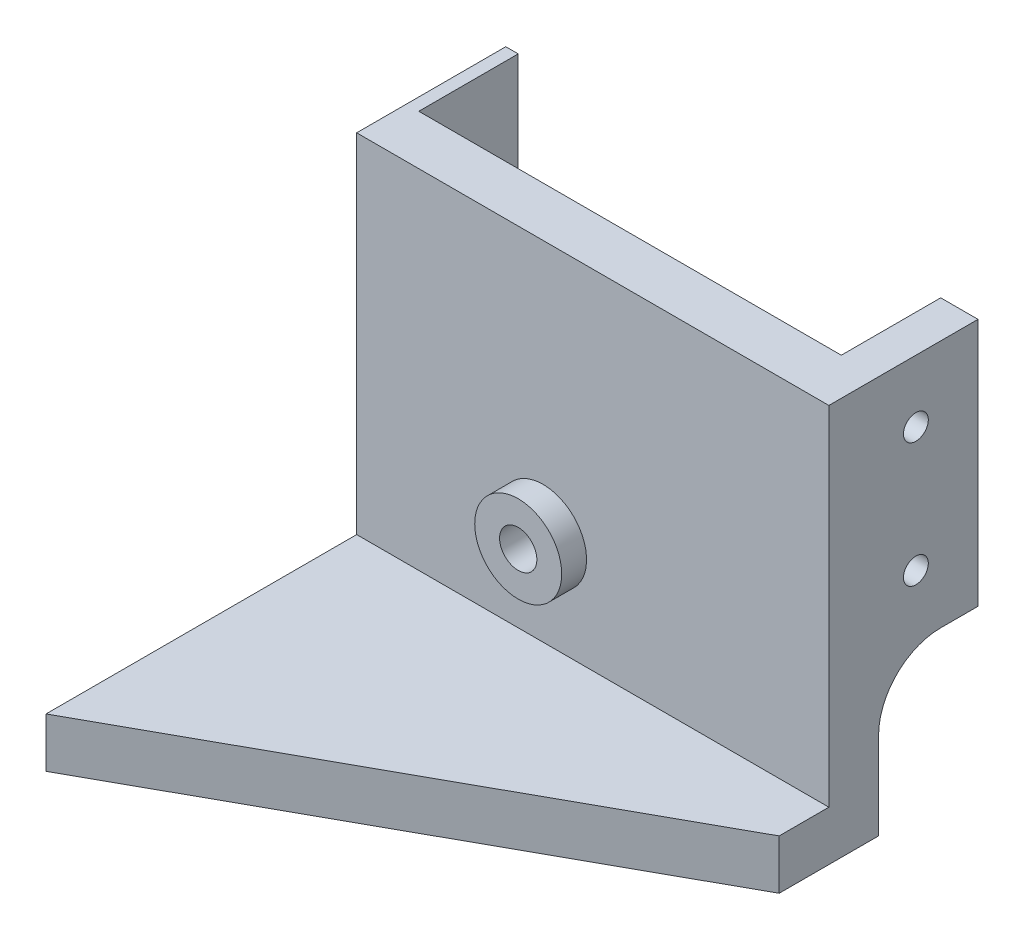
from build123d import *

# Parameters (mm, degrees)
BOSS_EXTRUDE1_DEPTH     = 20
SKETCH2_W               = 38
SKETCH2_H               = 4
BOSS_EXTRUDE2_DEPTH     = 12
FILLET1_R               = 5
SKETCH3_W               = 38
SKETCH3_H               = 4
BOSS_EXTRUDE3_DEPTH     = 25
SKETCH4_R               = 3.5
SKETCH4_R_2             = 1.5
BOSS_EXTRUDE4_DEPTH     = 2
SKETCH5_R               = 1.5
CUT_EXTRUDE1_DEPTH      = 49.713447835
CUT_EXTRUDE2_DEPTH      = 10
CUT_EXTRUDE3_DEPTH      = 50.689032995
CUT_EXTRUDE3_DEPTH_BACK = 50.689032995
SKETCH7_R               = 1


with BuildPart() as part:
    # Sketch1 → Boss-Extrude1 (new body)
    with BuildSketch(Plane(origin=(0, 0, 0), x_dir=(1, 0, 0), z_dir=(0, 1, 0))):
        Polygon((0, 12), (0, 0), (38, 0), (38, 12), (35, 12), (35, 4), (1, 4), (1, 12), align=None)
    extrude(amount=BOSS_EXTRUDE1_DEPTH)

    # Sketch2 → Boss-Extrude2 (add)
    with BuildSketch(Plane.XZ):
        with Locations((19, -2)):
            Rectangle(SKETCH2_W, SKETCH2_H)
    extrude(amount=BOSS_EXTRUDE2_DEPTH)

    # Fillet1
    fillet1_edges = [part.edges().sort_by_distance(p)[0] for p in [
        (36.5, 0, -4),
        (0.5, 0, -4),
    ]]
    fillet(fillet1_edges, radius=FILLET1_R)

    # Sketch3 → Boss-Extrude3 (add)
    with BuildSketch(Plane.XY):
        with Locations((19, -10)):
            Rectangle(SKETCH3_W, SKETCH3_H)
    extrude(amount=BOSS_EXTRUDE3_DEPTH)

    # Sketch4 → Boss-Extrude4 (add)
    with BuildSketch(Plane.XY):
        with Locations(Location((15, -0.5, 0), (0, 0, 180))):
            Circle(SKETCH4_R)
        with Locations((15, -0.5)):
            Circle(SKETCH4_R_2, mode=Mode.SUBTRACT)
    extrude(amount=BOSS_EXTRUDE4_DEPTH)

    # Sketch5 → Cut-Extrude1 (cut, through all)
    with BuildSketch(Plane.XY.offset(2)):
        with Locations(Location((15, -0.5, 0), (0, 0, 180))):
            Circle(SKETCH5_R)
    extrude(amount=-CUT_EXTRUDE1_DEPTH, mode=Mode.SUBTRACT)

    # Sketch6 → Cut-Extrude2 (cut)
    with BuildSketch(Plane(origin=(0, -8, 0), x_dir=(1, 0, 0), z_dir=(0, 1, 0))):
        Polygon((0, -25), (38, -4), (38, -25), align=None)
    extrude(amount=-CUT_EXTRUDE2_DEPTH, mode=Mode.SUBTRACT)

    # Sketch7 → Cut-Extrude3 (cut, two sides: drawn at the far end of the back side and taken through both)
    with BuildSketch(Plane.ZY.offset(-CUT_EXTRUDE3_DEPTH_BACK)):
        with Locations((-7, 15)):
            Circle(SKETCH7_R)
        with Locations((-7, 5)):
            Circle(SKETCH7_R)
    extrude(amount=CUT_EXTRUDE3_DEPTH + CUT_EXTRUDE3_DEPTH_BACK, mode=Mode.SUBTRACT)


solid = part.part
